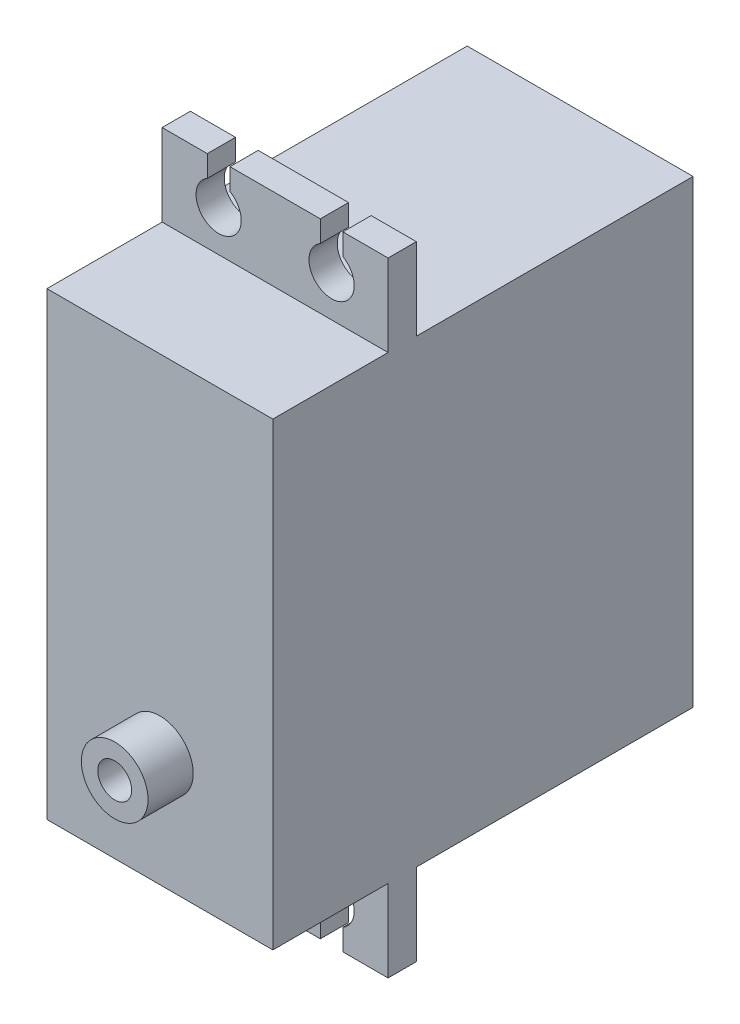
from build123d import *

# Parameters (mm, degrees)
BOSS_EXTRUDE1_DEPTH = 10
CUT_EXTRUDE1_DEPTH  = 40.884332764
SKETCH5_W           = 6
SKETCH5_H           = 3.5
BOSS_EXTRUDE2_DEPTH = 6
SKETCH2_R           = 2.95
SKETCH2_R_2         = 1.5
BOSS_EXTRUDE3_DEPTH = 4


with BuildPart() as part:
    # Sketch1 → Boss-Extrude1 (new, symmetric)
    with BuildSketch(Plane.YZ):
        Polygon((-20.35, 5.9), (-27.6, 5.9), (-27.6, 8.4), (-20.35, 8.4), (-20.35, 18.6), (20.35, 18.6), (20.35, 8.4), (27.6, 8.4), (27.6, 5.9), (20.35, 5.9), (20.35, -18.6), (-20.35, -18.6), align=None)
    extrude(amount=BOSS_EXTRUDE1_DEPTH, both=True)

    # Sketch4 → Cut-Extrude1 (cut, through all)
    with BuildSketch(Plane.XY.offset(8.4)):
        with BuildLine():
            Line((-6, -25.707050808), (-6, -27.6))
            Line((-6, -27.6), (-4, -27.6))
            Line((-4, -27.6), (-4, -25.707050808))
            ThreePointArc((-4, -25.707050808), (-5, -21.975), (-6, -25.707050808))
        make_face()
        with BuildLine():
            Line((6, -27.6), (4, -27.6))
            Line((4, -27.6), (4, -25.707050808))
            ThreePointArc((4, -25.707050808), (5, -21.975), (6, -25.707050808))
            Line((6, -25.707050808), (6, -27.6))
        make_face()
    cut_extrude1 = extrude(amount=-CUT_EXTRUDE1_DEPTH, mode=Mode.SUBTRACT)

    # Mirror1: Cut-Extrude1 across plane
    add(cut_extrude1.mirror(Plane.ZX), mode=Mode.SUBTRACT)

    # Sketch5 → Boss-Extrude2 (add)
    with BuildSketch(Plane.XZ.offset(20.35)):
        with Locations((0, -14.85)):
            Rectangle(SKETCH5_W, SKETCH5_H)
    extrude(amount=BOSS_EXTRUDE2_DEPTH)

    # Sketch2 → Boss-Extrude3 (add)
    with BuildSketch(Plane.XY.offset(18.6)):
        with Locations(Location((0, -10.35, 0), (0, 0, 180))):
            Circle(SKETCH2_R)
        with Locations((0, -10.35)):
            Circle(SKETCH2_R_2, mode=Mode.SUBTRACT)
    extrude(amount=BOSS_EXTRUDE3_DEPTH)


solid = part.part
